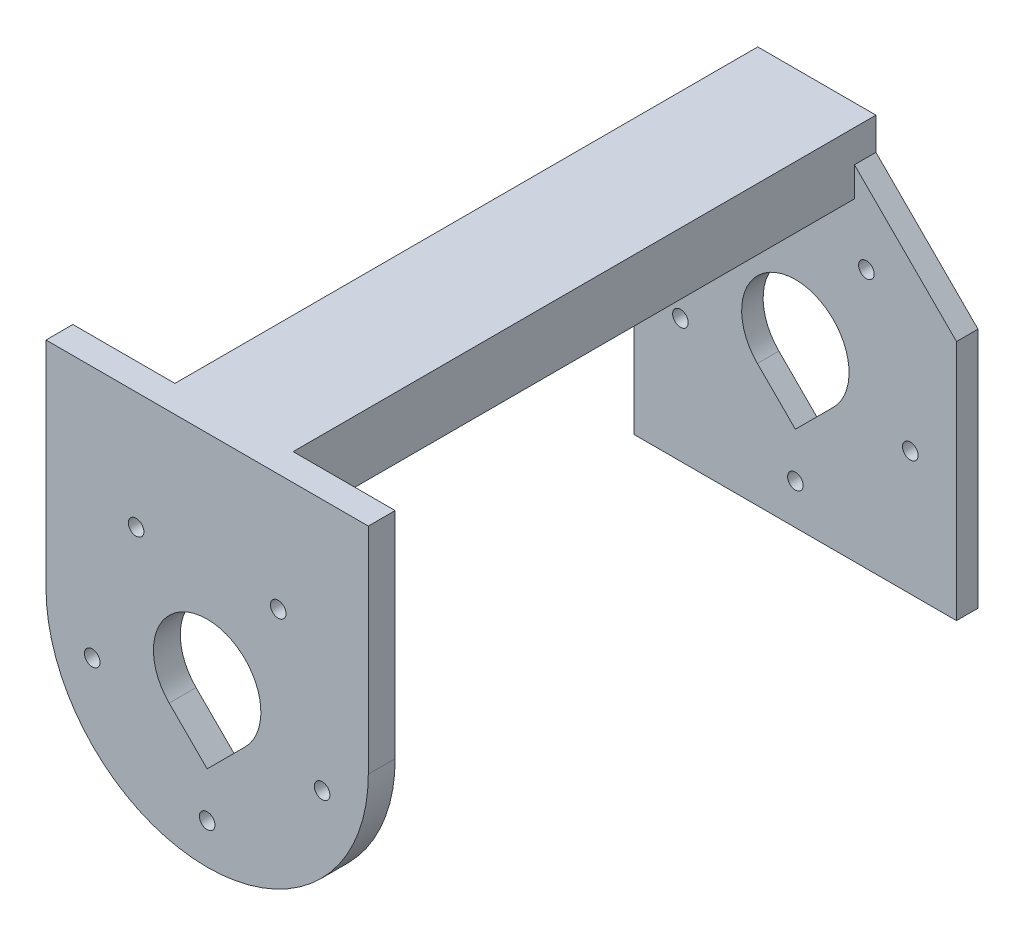
from build123d import *

# Parameters (mm, degrees)
SKETCH1_R           = 30
BOSS_EXTRUDE1_DEPTH = 5
SKETCH2_W           = 60
SKETCH2_H           = 40
BOSS_EXTRUDE2_DEPTH = 5
SKETCH3_R           = 1.45
CUT_EXTRUDE1_DEPTH  = 5
SKETCH4_R           = 1.45
BOSS_EXTRUDE3_DEPTH = 4
SKETCH5_W           = 22
SKETCH5_H           = 11.5
BOSS_EXTRUDE4_DEPTH = 108.5


with BuildPart() as part:
    # Sketch1 → Boss-Extrude1 (new body)
    with BuildSketch(Plane.XY.offset(384.5)):
        with Locations((300, 300)):
            Circle(SKETCH1_R)
    extrude(amount=BOSS_EXTRUDE1_DEPTH)

    # Sketch2 → Boss-Extrude2 (add)
    with BuildSketch(Plane.XY.offset(384.5)):
        with Locations((300, 320)):
            Rectangle(SKETCH2_W, SKETCH2_H)
    extrude(amount=BOSS_EXTRUDE2_DEPTH)

    # Sketch3 → Cut-Extrude1 (cut)
    with BuildSketch(Plane.XY.offset(384.5)):
        with Locations((286.774831823, 318.202882373)):
            Circle(SKETCH3_R)
        with Locations((278.601228383, 293.047117627)):
            Circle(SKETCH3_R)
        with Locations((300, 277.5)):
            Circle(SKETCH3_R)
        with Locations((321.398771617, 293.047117627)):
            Circle(SKETCH3_R)
        with Locations((313.225168177, 318.202882373)):
            Circle(SKETCH3_R)
        with BuildLine():
            Line((292.928932188, 292.928932188), (300, 285.857864376))
            Line((300, 285.857864376), (307.071067812, 292.928932188))
            ThreePointArc((307.071067812, 292.928932188), (300, 310), (292.928932188, 292.928932188))
        make_face()
    extrude(amount=CUT_EXTRUDE1_DEPTH, mode=Mode.SUBTRACT)



with BuildPart() as body_2:
    # Sketch4 → Boss-Extrude3 (new body)
    with BuildSketch(Plane.XY.offset(276)):
        Polygon((289, 340), (311, 340), (311, 334), (330, 315), (330, 270), (270, 270), (270, 315), (289, 334), align=None)
        with Locations((286.774831823, 318.202882373)):
            Circle(SKETCH4_R, mode=Mode.SUBTRACT)
        with Locations((278.601228383, 293.047117627)):
            Circle(SKETCH4_R, mode=Mode.SUBTRACT)
        with Locations((300, 277.5)):
            Circle(SKETCH4_R, mode=Mode.SUBTRACT)
        with Locations((321.398771617, 293.047117627)):
            Circle(SKETCH4_R, mode=Mode.SUBTRACT)
        with Locations((313.225168177, 318.202882373)):
            Circle(SKETCH4_R, mode=Mode.SUBTRACT)
        with BuildLine():
            Line((292.928932188, 292.928932188), (300, 285.857864376))
            Line((300, 285.857864376), (307.071067812, 292.928932188))
            ThreePointArc((307.071067812, 292.928932188), (300, 310), (292.928932188, 292.928932188))
        make_face(mode=Mode.SUBTRACT)
    extrude(amount=BOSS_EXTRUDE3_DEPTH)


with BuildPart() as part_1:
    add(part.part)

    add(body_2.part)  # Boss-Extrude4 merges body 2
    # Sketch5 → Boss-Extrude4 (add)
    with BuildSketch(Plane.XY.offset(276)):
        with Locations((300, 334.25)):
            Rectangle(SKETCH5_W, SKETCH5_H)
    extrude(amount=BOSS_EXTRUDE4_DEPTH)


solid = part_1.part
